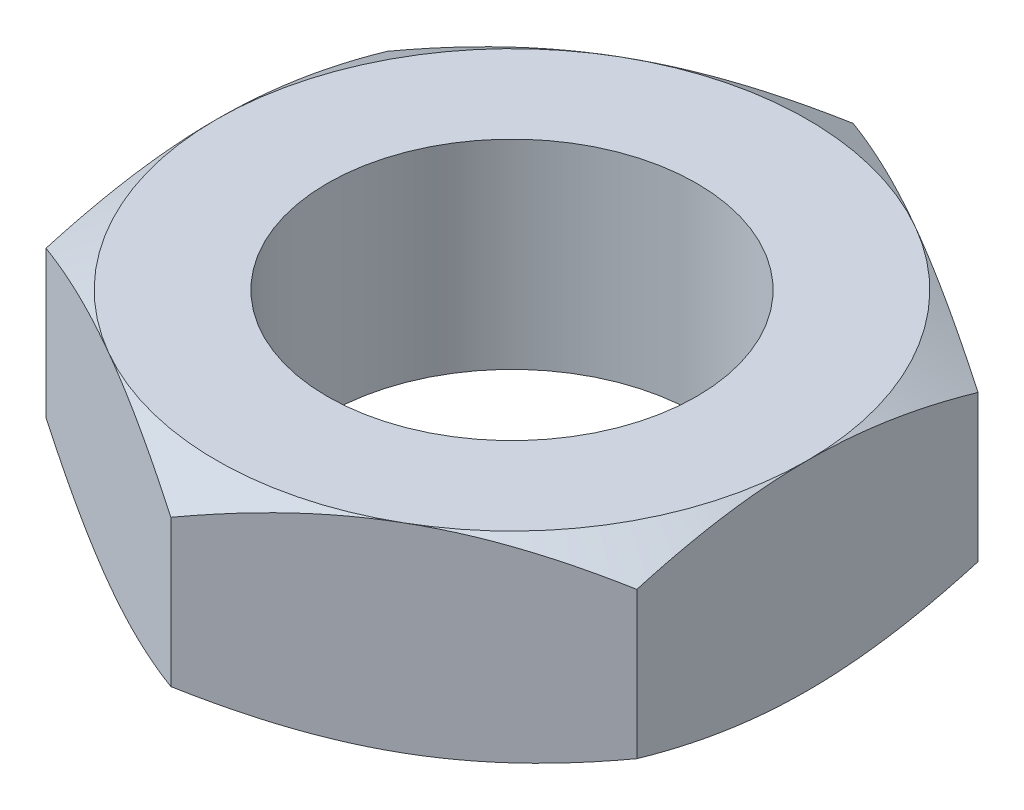
from build123d import *

# Parameters (mm, degrees)
SKETCH0_R               = 2.5
BOSS_EXTRUDE1_DEPTH     = 1.35
SKETCH5_OUTSIDE_W       = 39.108
SKETCH5_OUTSIDE_H       = 40.346
SKETCH5_OUTSIDE_R       = 4
CUT_EXTRUDE2_DEPTH      = 7.68006986
CUT_EXTRUDE2_DRAFT      = -60
MIRROR2_COPY_1_SKETCH_W = 39.108
MIRROR2_COPY_1_SKETCH_H = 40.346
MIRROR2_COPY_1_SKETCH_R = 4
MIRROR2_COPY_1_DEPTH    = 7.68006986
MIRROR2_COPY_1_DRAFT    = -60


with BuildPart() as part:
    # Sketch0 → Boss-Extrude1 (new, symmetric)
    with BuildSketch(Plane(origin=(0, 0, 0), x_dir=(1, 0, 0), z_dir=(0, 1, 0))):
        Polygon((-4, 2.309401077), (-4, -2.309401077), (0, -4.618802154), (4, -2.309401077), (4, 2.309401077), (0, 4.618802154), align=None)
        Circle(SKETCH0_R, mode=Mode.SUBTRACT)
    extrude(amount=BOSS_EXTRUDE1_DEPTH, both=True)


with BuildPart() as cut_extrude2_tool:
    # Sketch5 outside → Cut-Extrude2 (with draft: the straight prism first)
    with BuildSketch(Plane(origin=(0, 1.35, 0), x_dir=(1, 0, 0), z_dir=(0, 1, 0))):
        Rectangle(SKETCH5_OUTSIDE_W, SKETCH5_OUTSIDE_H)
        Circle(SKETCH5_OUTSIDE_R, mode=Mode.SUBTRACT)
    extrude(amount=-CUT_EXTRUDE2_DEPTH)
    # Cut-Extrude2: the draft: its side faces are tilted about the plane it starts from
    cut_extrude2_sides = [cut_extrude2_tool.faces().sort_by_distance(p)[0] for p in [
        (0, -2.49003493, 20.173),
        (19.554, -2.49003493, 0),
        (0, -2.49003493, -20.173),
        (-19.554, -2.49003493, 0),
        (-4, -2.49003493, 0),
    ]]
    draft(cut_extrude2_sides, Plane(origin=(0, 1.35, 0), x_dir=(1, 0, 0), z_dir=(0, 1, 0)), CUT_EXTRUDE2_DRAFT)


with BuildPart() as part_1:
    add(part.part)

    # Cut-Extrude2: cut by cut_extrude2_tool
    add(cut_extrude2_tool.part, mode=Mode.SUBTRACT)


with BuildPart() as mirror2_copy_1_tool:
    # Mirror2 copy 1 sketch → Mirror2 copy 1 (with draft: the straight prism first)
    with BuildSketch(Plane.XZ.offset(1.35)):
        Rectangle(MIRROR2_COPY_1_SKETCH_W, MIRROR2_COPY_1_SKETCH_H)
        Circle(MIRROR2_COPY_1_SKETCH_R, mode=Mode.SUBTRACT)
    extrude(amount=-MIRROR2_COPY_1_DEPTH)
    # Mirror2 copy 1: the draft: its side faces are tilted about the plane it starts from
    mirror2_copy_1_sides = [mirror2_copy_1_tool.faces().sort_by_distance(p)[0] for p in [
        (0, 2.49003493, 20.173),
        (19.554, 2.49003493, 0),
        (0, 2.49003493, -20.173),
        (-19.554, 2.49003493, 0),
        (-4, 2.49003493, 0),
    ]]
    draft(mirror2_copy_1_sides, Plane.XZ.offset(1.35), MIRROR2_COPY_1_DRAFT)


with BuildPart() as part_2:
    add(part_1.part)

    # Mirror2 copy 1: cut by mirror2_copy_1_tool
    add(mirror2_copy_1_tool.part, mode=Mode.SUBTRACT)


solid = part_2.part
